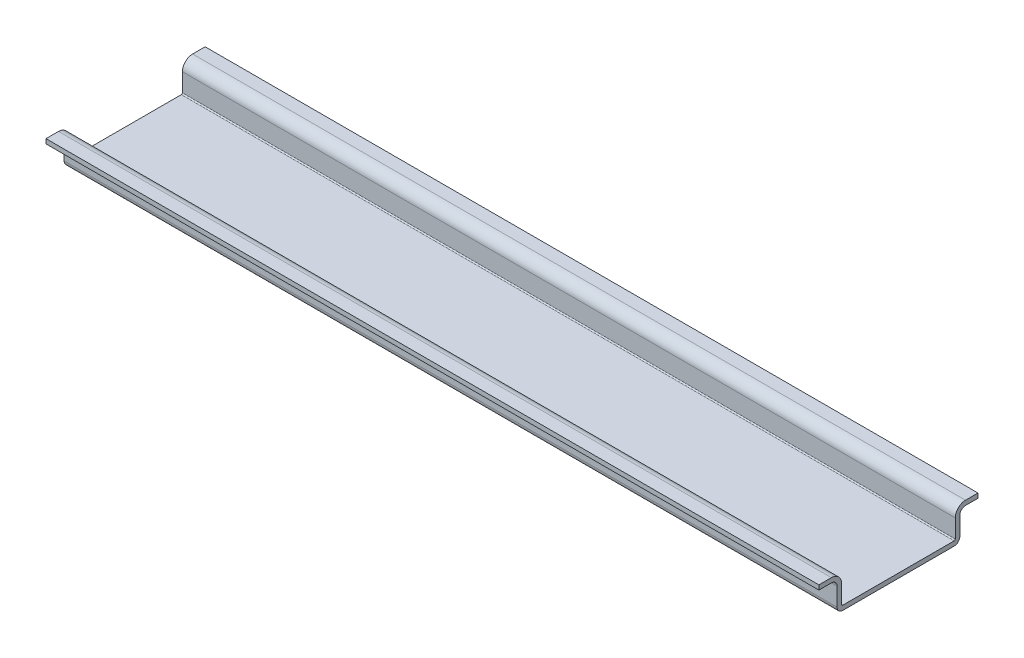
from build123d import *

# Parameters (mm, degrees)
OMEGA_TS_35_1_DEPTH = 170


with BuildPart() as part:
    # Sketch2 → Omega TS-35(1) (new body)
    with BuildSketch(Plane(origin=(-85, 0, 0), x_dir=(0, 0, -1), z_dir=(1, 0, 0))):
        with BuildLine():
            Line((12.25, 0), (-12.25, 0))
            ThreePointArc((-12.25, 0), (-13.133883476, 0.366116524), (-13.5, 1.25))
            Line((-13.5, 1.25), (-13.5, 5.25))
            ThreePointArc((-13.5, 5.25), (-13.866116524, 6.133883476), (-14.75, 6.5))
            Line((-14.75, 6.5), (-17.5, 6.5))
            Line((-17.5, 6.5), (-17.5, 7.5))
            Line((-17.5, 7.5), (-14.75, 7.5))
            ThreePointArc((-14.75, 7.5), (-13.159009742, 6.840990258), (-12.5, 5.25))
            Line((-12.5, 5.25), (-12.5, 1.25))
            ThreePointArc((-12.5, 1.25), (-12.426776695, 1.073223305), (-12.25, 1))
            Line((-12.25, 1), (12.25, 1))
            ThreePointArc((12.25, 1), (12.426776695, 1.073223305), (12.5, 1.25))
            Line((12.5, 1.25), (12.5, 5.25))
            ThreePointArc((12.5, 5.25), (13.159009742, 6.840990258), (14.75, 7.5))
            Line((14.75, 7.5), (17.5, 7.5))
            Line((17.5, 7.5), (17.5, 6.5))
            Line((17.5, 6.5), (14.75, 6.5))
            ThreePointArc((14.75, 6.5), (13.866116524, 6.133883476), (13.5, 5.25))
            Line((13.5, 5.25), (13.5, 1.25))
            ThreePointArc((13.5, 1.25), (13.133883476, 0.366116524), (12.25, 0))
        make_face()
    extrude(amount=OMEGA_TS_35_1_DEPTH)


solid = part.part
